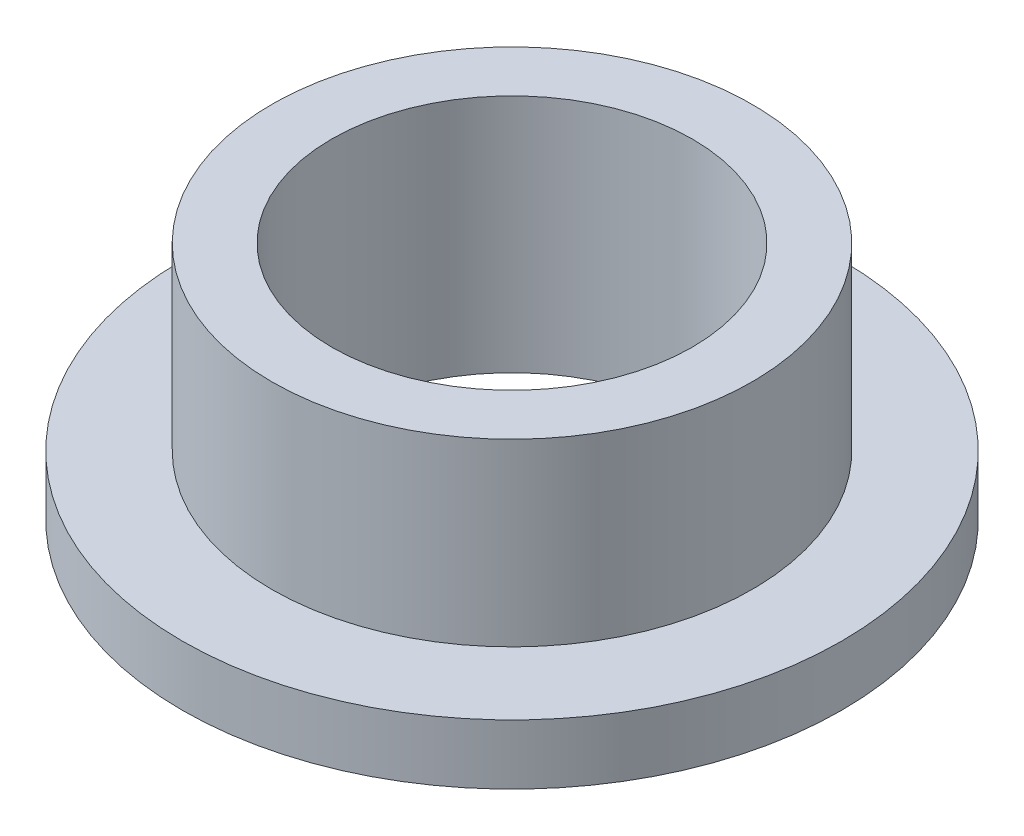
from build123d import *

# Parameters (mm, degrees)
SKETCH2_R           = 6.3627
SKETCH2_R_2         = 4.7752
BOSS_EXTRUDE1_DEPTH = 6.35
SKETCH3_R           = 8.73125
SKETCH3_R_2         = 6.3627
BOSS_EXTRUDE2_DEPTH = 1.5875


with BuildPart() as part:
    # Sketch2 → Boss-Extrude1 (new body)
    with BuildSketch(Plane(origin=(0, 0, 0), x_dir=(1, 0, 0), z_dir=(0, 1, 0))):
        with Locations(Location((0, 0, 0), (0, 0, 270))):
            Circle(SKETCH2_R)
        with Locations(Location((0, 0, 0), (0, 0, 270))):
            Circle(SKETCH2_R_2, mode=Mode.SUBTRACT)
    extrude(amount=BOSS_EXTRUDE1_DEPTH)

    # Sketch3 → Boss-Extrude2 (add)
    with BuildSketch(Plane(origin=(0, 0, 0), x_dir=(1, 0, 0), z_dir=(0, 1, 0))):
        with Locations(Location((0, 0, 0), (0, 0, 270))):
            Circle(SKETCH3_R)
        with Locations(Location((0, 0, 0), (0, 0, 270))):
            Circle(SKETCH3_R_2, mode=Mode.SUBTRACT)
    extrude(amount=BOSS_EXTRUDE2_DEPTH)


solid = part.part
